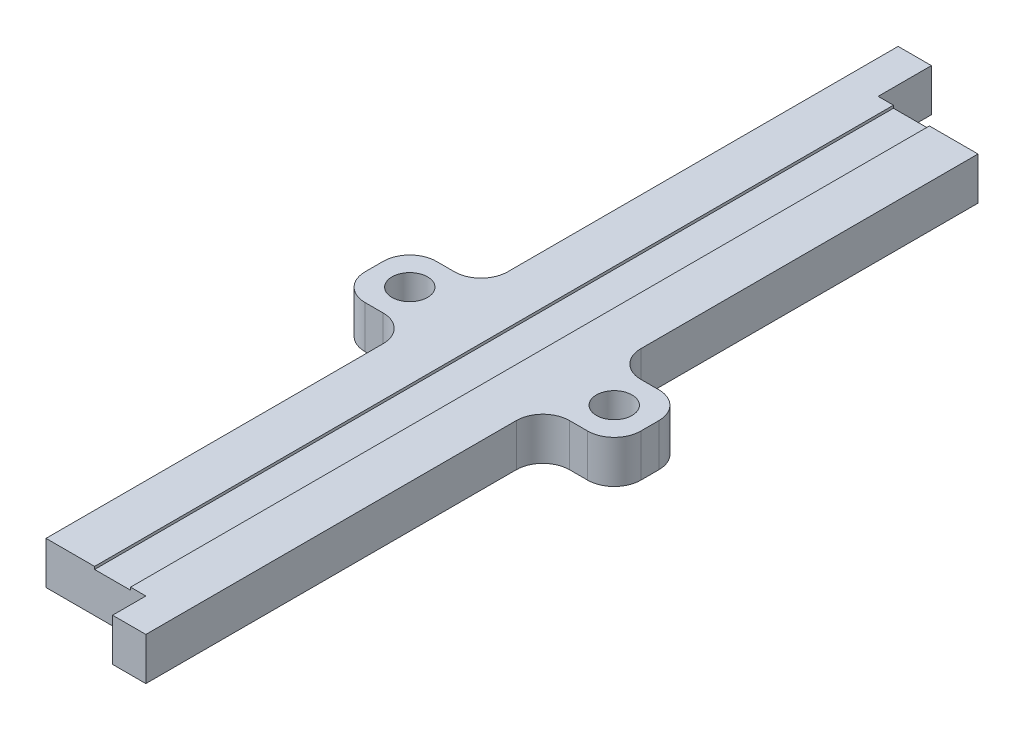
from build123d import *

# Parameters (mm, degrees)
SKETCH1_W               = 12.7
SKETCH1_H               = 4.064
BOSS_EXTRUDE1_DEPTH     = 228.6
SKETCH2_W               = 3.429
SKETCH2_H               = 217.3732
CUT_EXTRUDE1_DEPTH      = 0.254
SKETCH3_W               = 0.508
SKETCH3_H               = 5.08
CUT_EXTRUDE2_DEPTH      = 229.724285103
MIRROR2_COPY_1_SKETCH_W = 0.508
MIRROR2_COPY_1_SKETCH_H = 5.08
MIRROR2_COPY_1_DEPTH    = 229.724285103
SKETCH4_W               = 3.175
SKETCH4_H               = 3.175
CUT_EXTRUDE3_DEPTH      = 229.724285103
CUT_EXTRUDE5_DEPTH      = 229.724285103
SKETCH6_W               = 6.80212
SKETCH6_H               = 6.80212
SKETCH6_R               = 1.70053
BOSS_EXTRUDE2_DEPTH     = 4.064
FILLET1_R               = 2.54


with BuildPart() as part:
    # Sketch1 → Boss-Extrude1 (new body)
    with BuildSketch(Plane.XY):
        Rectangle(SKETCH1_W, SKETCH1_H)
    extrude(amount=BOSS_EXTRUDE1_DEPTH)

    # Sketch2 → Cut-Extrude1 (cut)
    with BuildSketch(Plane(origin=(0, 2.032, 0), x_dir=(1, 0, 0), z_dir=(0, 1, 0))):
        with Locations((0, -114.3)):
            Rectangle(SKETCH2_W, SKETCH2_H)
    extrude(amount=-CUT_EXTRUDE1_DEPTH, mode=Mode.SUBTRACT)

    # Sketch3 → Cut-Extrude2 (cut, through all)
    with BuildSketch(Plane(origin=(0, 2.032, 0), x_dir=(1, 0, 0), z_dir=(0, 1, 0))):
        with Locations((-6.096, -226.06)):
            Rectangle(SKETCH3_W, SKETCH3_H)
    cut_extrude2 = extrude(amount=-CUT_EXTRUDE2_DEPTH, mode=Mode.SUBTRACT)

    # Mirror1: Cut-Extrude2 across plane
    add(cut_extrude2.mirror(Plane(origin=(0, 0, 114.3), x_dir=(1, 0, 0), z_dir=(0, 0, -1))), mode=Mode.SUBTRACT)

    # Mirror2: Cut-Extrude2 across plane
    add(cut_extrude2.mirror(Plane(origin=(0, 0, 0), x_dir=(0, 0, 1), z_dir=(1, 0, 0))), mode=Mode.SUBTRACT)

    # Mirror2 copy 1 sketch → Mirror2 copy 1 (cut, through all)
    with BuildSketch(Plane(origin=(0, 2.032, 228.6), x_dir=(-1, 0, 0), z_dir=(0, 1, 0))):
        with Locations((-6.096, -226.06)):
            Rectangle(MIRROR2_COPY_1_SKETCH_W, MIRROR2_COPY_1_SKETCH_H)
    extrude(amount=-MIRROR2_COPY_1_DEPTH, mode=Mode.SUBTRACT)

    # Sketch4 → Cut-Extrude3 (cut, through all)
    with BuildSketch(Plane(origin=(0, 2.032, 0), x_dir=(1, 0, 0), z_dir=(0, 1, 0))):
        with Locations((-4.2545, -227.0125)):
            Rectangle(SKETCH4_W, SKETCH4_H)
    extrude(amount=-CUT_EXTRUDE3_DEPTH, mode=Mode.SUBTRACT)

    # Sketch5 → Cut-Extrude5 (cut, through all)
    with BuildSketch(Plane(origin=(0, 2.032, 0), x_dir=(1, 0, 0), z_dir=(0, 1, 0))):
        Polygon((-6.35, 0), (6.35, 0), (6.35, -76.2), (-3.175, -76.2), (-3.175, -71.12), (-6.35, -71.12), align=None)
        Polygon((-6.35, -152.4), (3.175, -152.4), (3.175, -155.575), (6.35, -155.575), (6.35, -228.6), (-6.35, -228.6), align=None)
    extrude(amount=-CUT_EXTRUDE5_DEPTH, mode=Mode.SUBTRACT)

    # Sketch6 → Boss-Extrude2 (add, through all)
    # profile 1 of 2: a face of its own
    with BuildSketch(Plane(origin=(0, 2.032, 0), x_dir=(1, 0, 0), z_dir=(0, 1, 0))):
        with Locations((-9.75106, -114.3)):
            Rectangle(SKETCH6_W, SKETCH6_H)
        with Locations(Location((-9.75106, -114.3, 0), (0, 0, 270))):
            Circle(SKETCH6_R, mode=Mode.SUBTRACT)
    # profile 2 of 2: a face of its own
    with BuildSketch(Plane(origin=(0, 2.032, 0), x_dir=(1, 0, 0), z_dir=(0, 1, 0))):
        with Locations((9.75106, -114.3)):
            Rectangle(SKETCH6_W, SKETCH6_H)
        with Locations(Location((9.75106, -114.3, 0), (0, 0, 270))):
            Circle(SKETCH6_R, mode=Mode.SUBTRACT)
    extrude(amount=-BOSS_EXTRUDE2_DEPTH)

    # Fillet1
    fillet1_edges = [part.edges().sort_by_distance(p)[0] for p in [
        (6.35, 0, 110.89894),
        (13.15212, 0, 110.89894),
        (13.15212, 0, 117.70106),
        (6.35, 0, 117.70106),
        (-6.35, 0, 117.70106),
        (-13.15212, 0, 117.70106),
        (-13.15212, 0, 110.89894),
        (-6.35, 0, 110.89894),
    ]]
    fillet(fillet1_edges, radius=FILLET1_R)


solid = part.part
